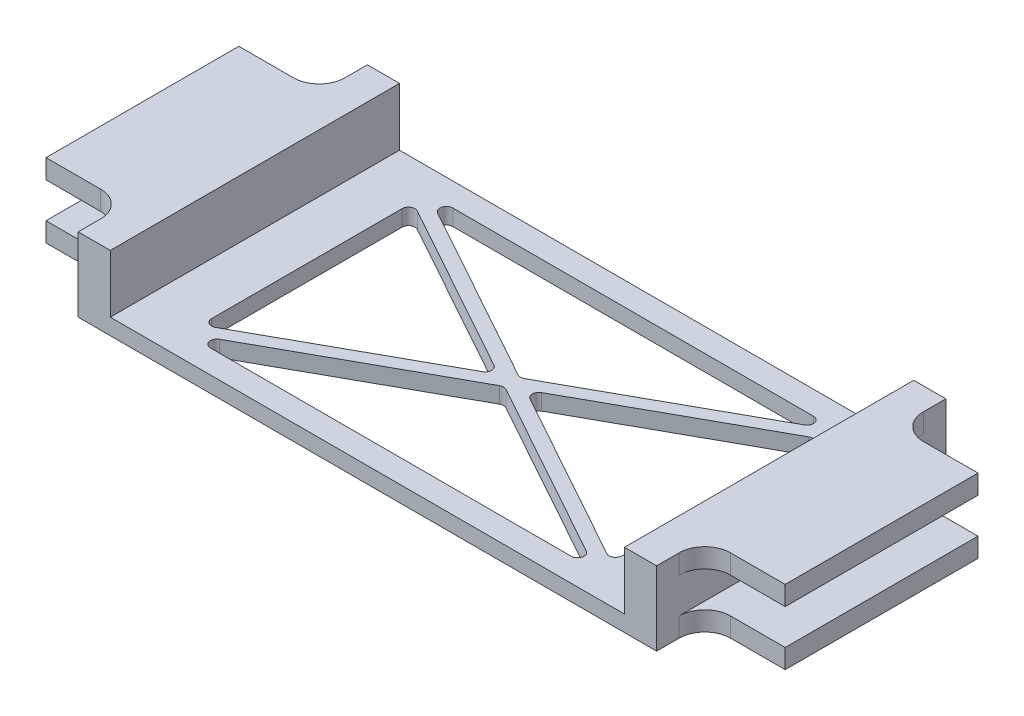
from build123d import *

# Parameters (mm, degrees)
SKETCH1_W               = 12.5
SKETCH1_H               = 30
SKETCH1_W_2             = 90
SKETCH1_H_2             = 7.5
BOSS_EXTRUDE1_DEPTH     = 11.5
SKETCH2_W               = 12.5
SKETCH2_H               = 5.5
CUT_EXTRUDE1_DEPTH      = 70.604238377
CUT_EXTRUDE2_DEPTH      = 74.915492287
CUT_EXTRUDE2_DEPTH_BACK = 74.915492287
SKETCH3_W               = 80
SKETCH3_H               = 9
FILLET1_R               = 4
CUT_EXTRUDE4_DEPTH      = 10


with BuildPart() as part:
    # Sketch1 → Boss-Extrude1 (new body)
    with BuildSketch(Plane(origin=(0, 0, 0), x_dir=(1, 0, 0), z_dir=(0, 1, 0))):
        with Locations((-51.25, 0)):
            Rectangle(SKETCH1_W, SKETCH1_H)
        with Locations((0, 18.75)):
            Rectangle(SKETCH1_W_2, SKETCH1_H_2)
        Rectangle(SKETCH1_W_2, SKETCH1_H)
        with Locations((0, -18.75)):
            Rectangle(SKETCH1_W_2, SKETCH1_H_2)
        with Locations((51.25, 0)):
            Rectangle(SKETCH1_W, SKETCH1_H)
    extrude(amount=BOSS_EXTRUDE1_DEPTH)

    # Sketch2 → Cut-Extrude1 (cut, through all)
    with BuildSketch(Plane.XY.offset(15)):
        with Locations((-51.25, 5.75)):
            Rectangle(SKETCH2_W, SKETCH2_H)
    cut_extrude1 = extrude(amount=-CUT_EXTRUDE1_DEPTH, mode=Mode.SUBTRACT)

    # Mirror1: Cut-Extrude1 across plane
    add(cut_extrude1.mirror(Plane(origin=(0, 0, 0), x_dir=(0, 0, 1), z_dir=(1, 0, 0))), mode=Mode.SUBTRACT)

    # Sketch3 → Cut-Extrude2 (cut, two sides: drawn at the far end of the back side and taken through both)
    with BuildSketch(Plane.XY.offset(22.5).offset(-CUT_EXTRUDE2_DEPTH_BACK)):
        with Locations((0, 7)):
            Rectangle(SKETCH3_W, SKETCH3_H)
    extrude(amount=CUT_EXTRUDE2_DEPTH + CUT_EXTRUDE2_DEPTH_BACK, mode=Mode.SUBTRACT)

    # Fillet1
    fillet1_edges = [part.edges().sort_by_distance(p)[0] for p in [
        (-45, 10, -15),
        (45, 10, -15),
        (45, 10, 15),
        (-45, 10, 15),
        (-45, 1.5, -15),
        (-45, 1.5, 15),
        (45, 1.5, -15),
        (45, 1.5, 15),
    ]]
    fillet(fillet1_edges, radius=FILLET1_R)

    # Sketch4 → Cut-Extrude4 (cut)
    with BuildSketch(Plane.XZ):
        with BuildLine():
            Line((28.542243556, 16.981698246), (0.484736979, 1.434191182))
            ThreePointArc((0.484736979, 1.434191182), (1.9718e-05, 1.308871184), (-0.484696575, 1.434194926))
            Line((-0.484696575, 1.434194926), (-28.54169207, 16.981701989))
            ThreePointArc((-28.54169207, 16.981701989), (-29.025159296, 18.106701788), (-28.05699548, 18.856384341))
            Line((-28.05699548, 18.856384341), (28.057553721, 18.856384341))
            ThreePointArc((28.057553721, 18.856384341), (29.025718505, 18.106698049), (28.542243556, 16.981698246))
        make_face()
        with BuildLine():
            Line((30.469394666, 15.718709145), (3.68189804, 0.874682353))
            ThreePointArc((3.68189804, 0.874682353), (3.166594631, 4e-09), (3.68189804, -0.874682346))
            Line((3.68189804, -0.874682346), (30.442216306, -15.703648524))
            ThreePointArc((30.442216306, -15.703648524), (31.434112297, -15.690794907), (31.926912476, -14.829882101))
            Line((31.926912476, -14.829882101), (31.954090836, 14.843110865))
            ThreePointArc((31.954090836, 14.843110865), (31.462079818, 15.705390608), (30.469394666, 15.718709145))
        make_face()
        with BuildLine():
            Line((-3.681898037, -0.874682351), (-30.440662807, -15.70278767))
            ThreePointArc((-30.440662807, -15.70278767), (-31.432953433, -15.689701683), (-31.925359397, -14.828105319))
            Line((-31.925359397, -14.828105319), (-31.925359397, 14.828105319))
            ThreePointArc((-31.925359397, 14.828105319), (-31.432953433, 15.689701683), (-30.440662807, 15.70278767))
            Line((-30.440662807, 15.70278767), (-3.681898036, 0.874682346))
            ThreePointArc((-3.681898036, 0.874682346), (-3.166594628, -3e-09), (-3.681898037, -0.874682351))
        make_face()
        with BuildLine():
            Line((-28.057615345, -18.856727819), (28.036669402, -18.856727819))
            ThreePointArc((28.036669402, -18.856727819), (29.004796923, -18.107185608), (28.521619558, -16.982186027))
            Line((28.521619558, -16.982186027), (0.484065329, -1.434825803))
            ThreePointArc((0.484065329, -1.434825803), (-0.000739868, -1.309367606), (-0.485581416, -1.434685244))
            Line((-0.485581416, -1.434685244), (-28.542311935, -16.982045468))
            ThreePointArc((-28.542311935, -16.982045468), (-29.025779162, -18.107045266), (-28.057615345, -18.856727819))
        make_face()
    extrude(amount=-CUT_EXTRUDE4_DEPTH, mode=Mode.SUBTRACT)


solid = part.part
